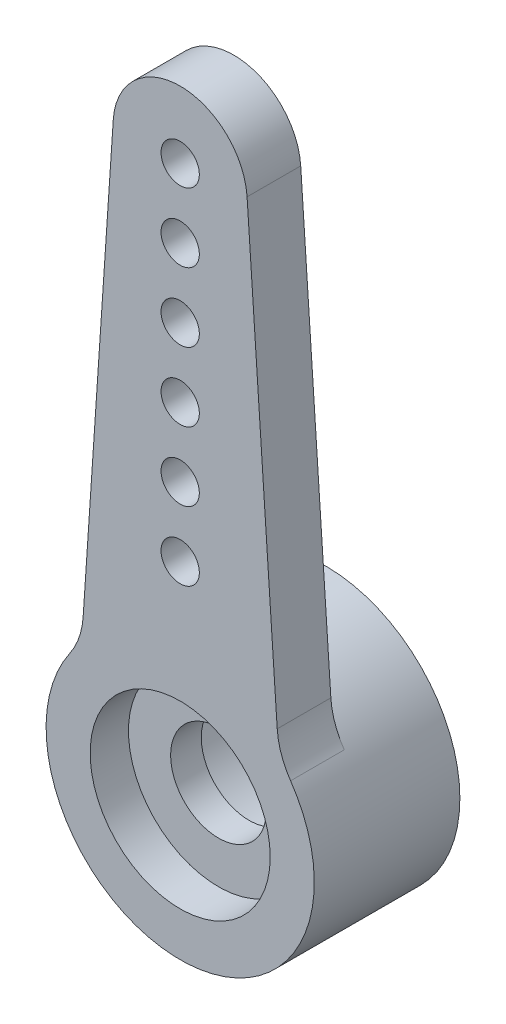
from build123d import *

# Parameters (mm, degrees)
SKIZZE1_R                       = 3.5
SKIZZE1_R_2                     = 1.25
AUFSATZ_LINEAR_AUSTRAGEN1_DEPTH = 3.8
SKIZZE2_R                       = 0.5
AUFSATZ_LINEAR_AUSTRAGEN2_DEPTH = 1.4
SKIZZE3_R                       = 2.35
SCHNITT_LINEAR_AUSTRAGEN1_DEPTH = 1
SCHNITT_LINEAR_START            = -2
SKIZZE4_R                       = 2.35
SCHNITT_LINEAR_AUSTRAGEN2_DEPTH = 2
VERRUNDUNG1_R                   = 2


with BuildPart() as part:
    # Skizze1 → Aufsatz-Linear austragen1 (new body)
    with BuildSketch(Plane.XY):
        with Locations(Location((0, 0, 0), (0, 0, 180))):
            Circle(SKIZZE1_R)
        with Locations(Location((0, 0, 0), (0, 0, 180))):
            Circle(SKIZZE1_R_2, mode=Mode.SUBTRACT)
    extrude(amount=AUFSATZ_LINEAR_AUSTRAGEN1_DEPTH)

    # Skizze2 → Aufsatz-Linear austragen2 (add)
    with BuildSketch(Plane.XY.offset(3.8)):
        with BuildLine():
            Line((2.65, 1.25), (-2.65, 1.25))
            Line((-2.65, 1.25), (-1.746012422, 14.618070409))
            ThreePointArc((-1.746012422, 14.618070409), (0, 16.25), (1.746012422, 14.618070409))
            Line((1.746012422, 14.618070409), (2.65, 1.25))
        make_face()
        with Locations((0, 14.5)):
            Circle(SKIZZE2_R, mode=Mode.SUBTRACT)
        with Locations((0, 12.7)):
            Circle(SKIZZE2_R, mode=Mode.SUBTRACT)
        with Locations((0, 10.9)):
            Circle(SKIZZE2_R, mode=Mode.SUBTRACT)
        with Locations((0, 9.1)):
            Circle(SKIZZE2_R, mode=Mode.SUBTRACT)
        with Locations((0, 7.3)):
            Circle(SKIZZE2_R, mode=Mode.SUBTRACT)
        with Locations((0, 5.5)):
            Circle(SKIZZE2_R, mode=Mode.SUBTRACT)
    extrude(amount=-AUFSATZ_LINEAR_AUSTRAGEN2_DEPTH)

    # Skizze3 → Schnitt-Linear austragen1 (cut)
    with BuildSketch(Plane.XY.offset(3.8)):
        Circle(SKIZZE3_R)
    extrude(amount=-SCHNITT_LINEAR_AUSTRAGEN1_DEPTH, mode=Mode.SUBTRACT)

    # Skizze4 → Schnitt-Linear austragen2 (cut)
    with BuildSketch(Plane(origin=(0, 0, 0), x_dir=(-1, 0, 0), z_dir=(0, 0, -1)).offset(SCHNITT_LINEAR_START)):
        with Locations(Location((0, 0, 0), (0, 0, 180))):
            Circle(SKIZZE4_R)
    extrude(amount=SCHNITT_LINEAR_AUSTRAGEN2_DEPTH, mode=Mode.SUBTRACT)

    # Verrundung1
    verrundung1_edges = [part.edges().sort_by_distance(p)[0] for p in [
        (-2.5741658, 2.371427931, 3.1),
        (2.5741658, 2.371427931, 3.1),
    ]]
    fillet(verrundung1_edges, radius=VERRUNDUNG1_R)


solid = part.part
